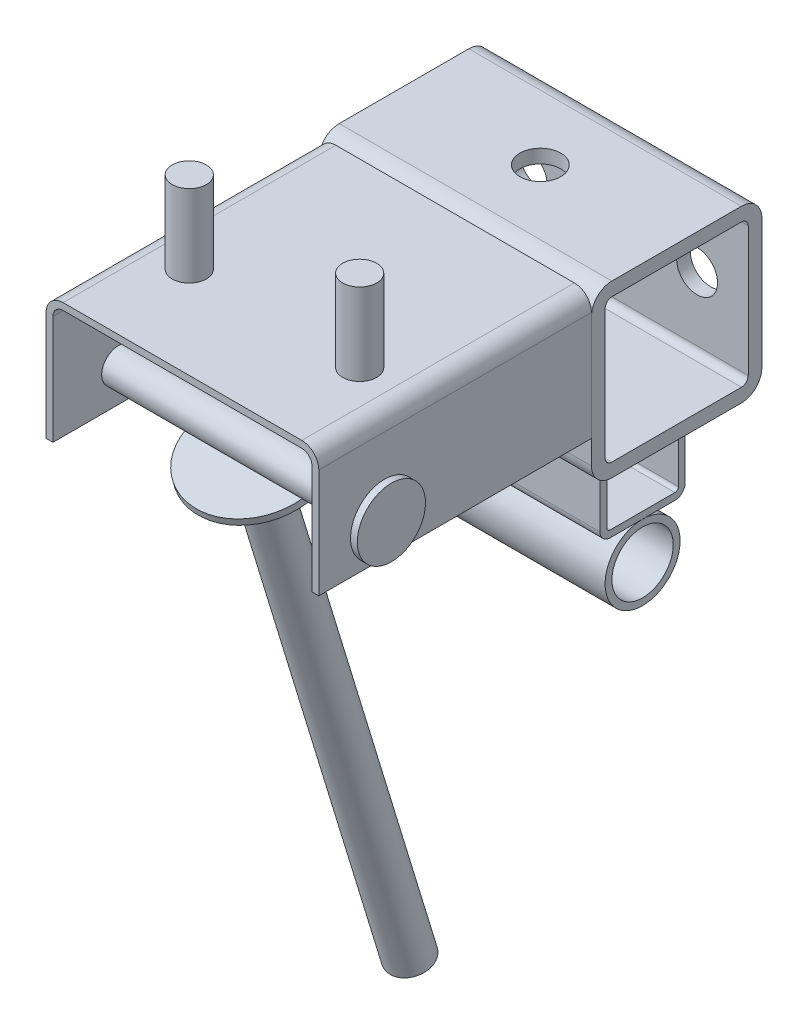
from build123d import *

# Parameters (mm, degrees)
BXBXS_8639_82_50_X_50_X_4_1_DEPTH = 80
EXTRUDE_1_DEPTH                   = 80
BXBXS_8639_82_25_X_25_X_2_1_DEPTH = 60
SKETCH_6_R                        = 11
SKETCH_6_R_2                      = 9
EXTRUDE_2_DEPTH                   = 60
SKETCH_7_R                        = 10
SKETCH_7_R_2                      = 5
EXTRUDE_3_DEPTH                   = 2
SKETCH_7_3_R                      = 5
EXTRUDE_4_DEPTH                   = 82
SKETCH_8_R                        = 17.5
EXTRUDE_5_DEPTH                   = 2
SKETCH_9_R                        = 5
EXTRUDE_6_DEPTH                   = 24
EXTRUDE_6_2_DEPTH                 = 24
SKETCH_10_R                       = 6
CUT_EXTRUDE_1_DEPTH               = 4
SKETCH_11_R                       = 6
CUT_EXTRUDE_2_DEPTH               = 4
SKETCH_12_R                       = 6
EXTRUDE_7_DEPTH                   = 155


with BuildPart() as part:
    # Sketch1 → Труба bxbxs гост8639-82 50 X 50 X 4(1) (new body)
    with BuildSketch(Plane.YZ.offset(-40)):
        with BuildLine():
            Line((-19, -25), (19, -25))
            ThreePointArc((19, -25), (23.242640687, -23.242640687), (25, -19))
            Line((25, -19), (25, 19))
            ThreePointArc((25, 19), (23.242640687, 23.242640687), (19, 25))
            Line((19, 25), (-19, 25))
            ThreePointArc((-19, 25), (-23.242640687, 23.242640687), (-25, 19))
            Line((-25, 19), (-25, -19))
            ThreePointArc((-25, -19), (-23.242640687, -23.242640687), (-19, -25))
        make_face()
        with BuildLine():
            Line((-19, -21), (19, -21))
            ThreePointArc((19, -21), (20.414213562, -20.414213562), (21, -19))
            Line((21, -19), (21, 19))
            ThreePointArc((21, 19), (20.414213562, 20.414213562), (19, 21))
            Line((19, 21), (-19, 21))
            ThreePointArc((-19, 21), (-20.414213562, 20.414213562), (-21, 19))
            Line((-21, 19), (-21, -19))
            ThreePointArc((-21, -19), (-20.414213562, -20.414213562), (-19, -21))
        make_face(mode=Mode.SUBTRACT)
    extrude(amount=BXBXS_8639_82_50_X_50_X_4_1_DEPTH)

    # Эскиз10 → Вырез-Вытянуть1 (cut)
    with BuildSketch(Plane(origin=(0, 25, 0), x_dir=(1, 0, 0), z_dir=(0, 1, 0))):
        with Locations(Location((0, 0, 0), (0, 0, 270))):
            Circle(SKETCH_10_R)
    extrude(amount=-CUT_EXTRUDE_1_DEPTH, mode=Mode.SUBTRACT)

    # Эскиз11 → Вырез-Вытянуть2 (cut)
    with BuildSketch(Plane(origin=(0, 0, -25), x_dir=(-1, 0, 0), z_dir=(0, 0, -1))):
        with Locations((25, 0)):
            Circle(SKETCH_11_R)
        with Locations((-25, 0)):
            Circle(SKETCH_11_R)
    extrude(amount=-CUT_EXTRUDE_2_DEPTH, mode=Mode.SUBTRACT)


with BuildPart() as body_2:
    # Эскиз3 → Бобышка-Вытянуть1 (new body)
    with BuildSketch(Plane.XY.offset(25)):
        with BuildLine():
            Line((-40, -12), (-40, 20))
            ThreePointArc((-40, 20), (-38.535533906, 23.535533906), (-35, 25))
            Line((-35, 25), (35, 25))
            ThreePointArc((35, 25), (38.535533906, 23.535533906), (40, 20))
            Line((40, 20), (40, -12))
            Line((40, -12), (38, -12))
            Line((38, -12), (38, 20))
            ThreePointArc((38, 20), (37.121320344, 22.121320344), (35, 23))
            Line((35, 23), (-35, 23))
            ThreePointArc((-35, 23), (-37.121320344, 22.121320344), (-38, 20))
            Line((-38, 20), (-38, -12))
            Line((-38, -12), (-40, -12))
        make_face()
    extrude(amount=EXTRUDE_1_DEPTH)


with BuildPart() as body_3:
    # Sketch11 → Труба bxbxs гост8639-82 25 X 25 X 2(1) (new body)
    with BuildSketch(Plane(origin=(30, -37.5, 0), x_dir=(0, 0, -1), z_dir=(-1, 0, 0))):
        with BuildLine():
            Line((-9.5, -12.5), (9.5, -12.5))
            ThreePointArc((9.5, -12.5), (11.621320344, -11.621320344), (12.5, -9.5))
            Line((12.5, -9.5), (12.5, 9.5))
            ThreePointArc((12.5, 9.5), (11.621320344, 11.621320344), (9.5, 12.5))
            Line((9.5, 12.5), (-9.5, 12.5))
            ThreePointArc((-9.5, 12.5), (-11.621320344, 11.621320344), (-12.5, 9.5))
            Line((-12.5, 9.5), (-12.5, -9.5))
            ThreePointArc((-12.5, -9.5), (-11.621320344, -11.621320344), (-9.5, -12.5))
        make_face()
        with BuildLine():
            Line((-9.5, -10.5), (9.5, -10.5))
            ThreePointArc((9.5, -10.5), (10.207106781, -10.207106781), (10.5, -9.5))
            Line((10.5, -9.5), (10.5, 9.5))
            ThreePointArc((10.5, 9.5), (10.207106781, 10.207106781), (9.5, 10.5))
            Line((9.5, 10.5), (-9.5, 10.5))
            ThreePointArc((-9.5, 10.5), (-10.207106781, 10.207106781), (-10.5, 9.5))
            Line((-10.5, 9.5), (-10.5, -9.5))
            ThreePointArc((-10.5, -9.5), (-10.207106781, -10.207106781), (-9.5, -10.5))
        make_face(mode=Mode.SUBTRACT)
    extrude(amount=BXBXS_8639_82_25_X_25_X_2_1_DEPTH)


with BuildPart() as body_4:
    # Эскиз6 → Бобышка-Вытянуть2 (new body)
    with BuildSketch(Plane(origin=(30, 0, 0), x_dir=(0, 0, -1), z_dir=(1, 0, 0))):
        with Locations((0, -61)):
            Circle(SKETCH_6_R)
        with Locations((0, -61)):
            Circle(SKETCH_6_R_2, mode=Mode.SUBTRACT)
    extrude(amount=-EXTRUDE_2_DEPTH)


with BuildPart() as body_5:
    # Эскиз7 → Бобышка-Вытянуть3 (new body)
    # profile 1 of 2: a face of its own
    with BuildSketch(Plane(origin=(40, 0, 0), x_dir=(0, 0, -1), z_dir=(1, 0, 0))):
        with Locations((-85.7, -2)):
            Circle(SKETCH_7_R)
        with Locations((-85.7, -2)):
            Circle(SKETCH_7_R_2, mode=Mode.SUBTRACT)
    # profile 2 of 2: a face of its own
    with BuildSketch(Plane(origin=(40, 0, 0), x_dir=(0, 0, -1), z_dir=(1, 0, 0))):
        with Locations((-85.7, -2)):
            Circle(SKETCH_7_R_2)
    extrude(amount=EXTRUDE_3_DEPTH)


with BuildPart() as body_6:
    # Зеркальное отражение1: mirrored copy
    add(body_5.part.mirror(Plane(origin=(0, 0, 0), x_dir=(0, 0, 1), z_dir=(1, 0, 0))))


with BuildPart() as body_7:
    # Эскиз7<3> → Бобышка-Вытянуть4 (new body)
    with BuildSketch(Plane(origin=(40, 0, 0), x_dir=(0, 0, -1), z_dir=(1, 0, 0))):
        with Locations((-85.7, -2)):
            Circle(SKETCH_7_3_R)
    extrude(amount=-EXTRUDE_4_DEPTH)


with BuildPart() as body_8:
    # Эскиз8 → Бобышка-Вытянуть5 (new body)
    with BuildSketch(Plane(origin=(0, 17.350854561, 5.304688589), x_dir=(1, 0, 0), z_dir=(0, -0.9563047559630353, -0.2923717047227373))):
        with Locations(Location((0, 82.540060995, 0), (0, 0, 270))):
            Circle(SKETCH_8_R)
    extrude(amount=EXTRUDE_5_DEPTH)


with BuildPart() as body_9:
    # Эскиз9 → Бобышка-Вытянуть6 (new body)
    with BuildSketch(Plane(origin=(0, 25, 0), x_dir=(1, 0, 0), z_dir=(0, 1, 0))):
        with Locations(Location((-25, -78, 0), (0, 0, 270))):
            Circle(SKETCH_9_R)
    extrude(amount=EXTRUDE_6_DEPTH)


with BuildPart() as body_10:
    # Эскиз9 → Extrude 6 2 (new body)
    with BuildSketch(Plane(origin=(0, 25, 0), x_dir=(1, 0, 0), z_dir=(0, 1, 0))):
        with Locations(Location((25, -78, 0), (0, 0, 270))):
            Circle(SKETCH_9_R)
    extrude(amount=EXTRUDE_6_2_DEPTH)


with BuildPart() as body_11:
    # Эскиз12 → Бобышка-Вытянуть7 (new body)
    with BuildSketch(Plane(origin=(0, 15.438245049, 4.719945179), x_dir=(1, 0, 0), z_dir=(0, -0.9563047559630353, -0.2923717047227373))):
        with Locations(Location((0, 82.540060995, 0), (0, 0, 270))):
            Circle(SKETCH_12_R)
    extrude(amount=EXTRUDE_7_DEPTH)


solid = Compound([part.part, body_2.part, body_3.part, body_4.part, body_5.part, body_6.part, body_7.part, body_8.part, body_9.part, body_10.part, body_11.part])
